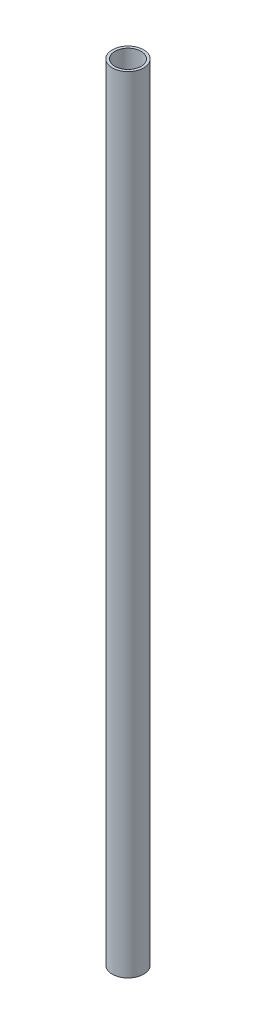
from build123d import *

# Parameters (mm, degrees)
SKETCH1_R           = 6
SKETCH1_R_2         = 5
BOSS_EXTRUDE1_DEPTH = 300


with BuildPart() as part:
    # Sketch1 → Boss-Extrude1 (new body)
    with BuildSketch(Plane(origin=(0, 0, 0), x_dir=(1, 0, 0), z_dir=(0, 1, 0))):
        with Locations(Location((0, 0, 0), (0, 0, 270))):
            Circle(SKETCH1_R)
        with Locations(Location((0, 0, 0), (0, 0, 270))):
            Circle(SKETCH1_R_2, mode=Mode.SUBTRACT)
    extrude(amount=BOSS_EXTRUDE1_DEPTH)


solid = part.part
